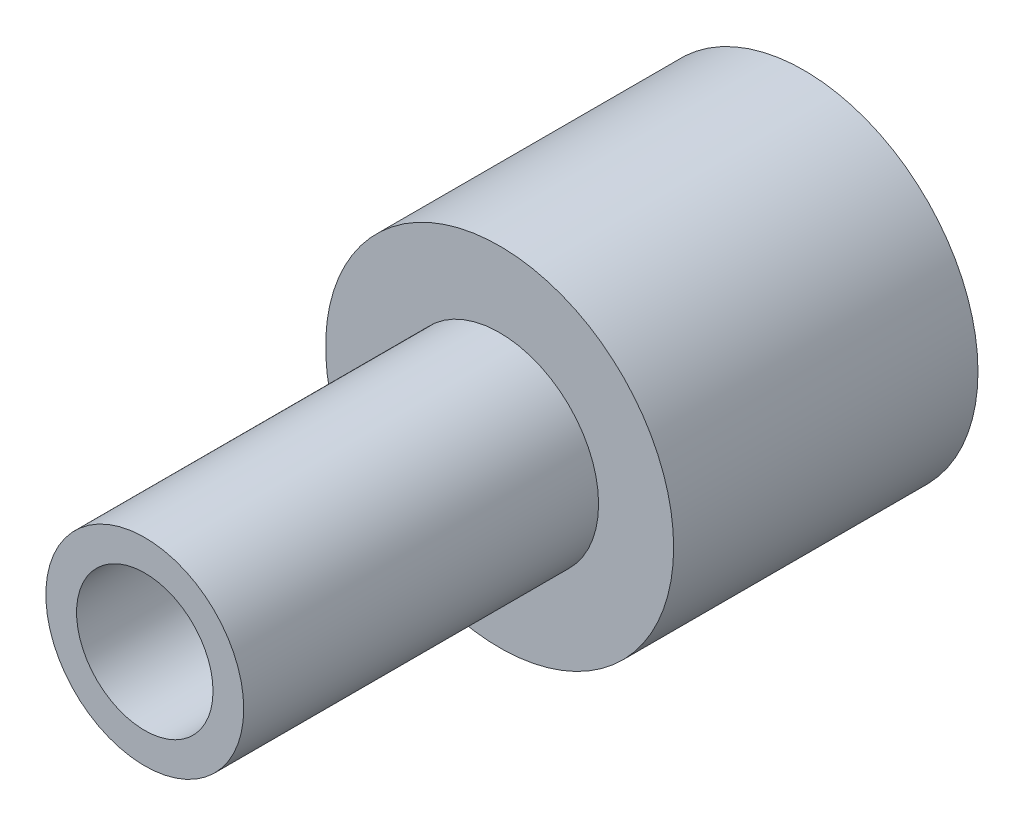
from build123d import *

# Parameters (mm, degrees)
SKETCH1_R          = 0.6477
SKETCH1_R_2        = 0.254
EXTRUDE1_DEPTH     = 1.13284
SKETCH2_R          = 0.3683
EXTRUDE2_DEPTH     = 1.3208
CUT_EXTRUDE1_REACH = 3.607
SKETCH4_R          = 0.254


with BuildPart() as part:
    # Sketch1 → Extrude1 (new body)
    with BuildSketch(Plane.XY):
        Circle(SKETCH1_R)
        Circle(SKETCH1_R_2, mode=Mode.SUBTRACT)
    extrude(amount=-EXTRUDE1_DEPTH)

    # Sketch2 → Extrude2 (add)
    with BuildSketch(Plane.XY):
        Circle(SKETCH2_R)
    extrude(amount=EXTRUDE2_DEPTH)

    # Sketch4 → Cut-Extrude1 (cut, up to next)
    with BuildSketch(Plane(origin=(0, 0, 0), x_dir=(-1, 0, 0), z_dir=(0, 0, -1)), mode=Mode.PRIVATE) as cut_extrude1_sk1:
        with Locations(Location((0, 0, 0), (0, 0, 180))):
            Circle(SKETCH4_R)
    cut_extrude1_tool1 = extrude(cut_extrude1_sk1.sketch, amount=-CUT_EXTRUDE1_REACH, mode=Mode.PRIVATE) & part.part
    add(cut_extrude1_tool1.solids().sort_by_distance((0, 0, 0))[0], mode=Mode.SUBTRACT)


solid = part.part
